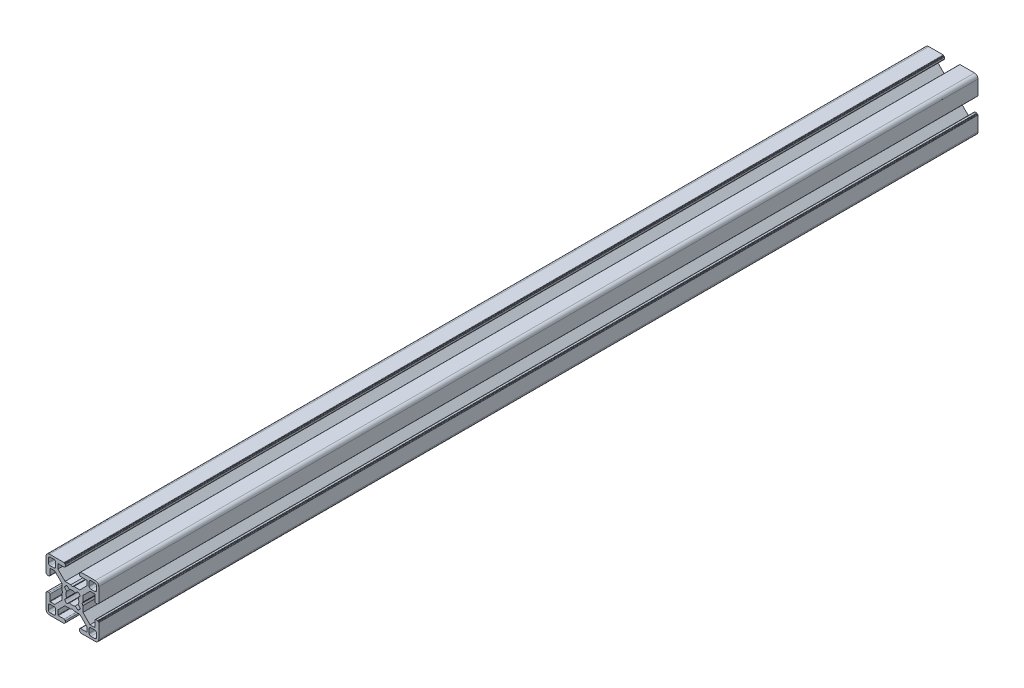
from build123d import *

# Parameters (mm, degrees)
DODANIE_WYCI_GNI_CIE1_DEPTH = 500


with BuildPart() as part:
    # Szkic1 → Dodanie-wyciągnięcie1 (new body)
    with BuildSketch(Plane.XY):
        with BuildLine():
            Line((96.56, 29.575148163), (97.459999946, 29.06))
            Line((97.459999946, 29.06), (100.764466193, 29.06))
            Line((100.764466193, 29.06), (104.810000327, 25.010000763))
            Line((104.810000327, 25.010000763), (104.810000327, 22.460001166))
            ThreePointArc((104.810000327, 22.460001166), (104.751421565, 22.318579525), (104.609999924, 22.260000763))
            Line((104.609999924, 22.260000763), (101.210000197, 22.260000763))
            ThreePointArc((101.210000197, 22.260000763), (100.785735989, 22.084264774), (100.61, 21.660000566))
            Line((100.61, 21.660000566), (100.61, 20.760000374))
            ThreePointArc((100.61, 20.760000374), (100.668578753, 20.618578753), (100.810000374, 20.56))
            Line((100.810000374, 20.56), (100.910000144, 20.56))
            ThreePointArc((100.910000144, 20.56), (101.05142109, 20.501421526), (101.109999564, 20.36000058))
            Line((101.109999564, 20.36000058), (101.109999564, 20.260000381))
            ThreePointArc((101.109999564, 20.260000381), (101.16857832, 20.118578755), (101.309999945, 20.06))
            Line((101.309999945, 20.06), (109.560000346, 20.06))
            ThreePointArc((109.560000346, 20.06), (110.974213664, 20.645786336), (111.56, 22.059999654))
            Line((111.56, 22.059999654), (111.56, 30.310000479))
            ThreePointArc((111.56, 30.310000479), (111.501421273, 30.451422036), (111.359999716, 30.510000763))
            Line((111.359999716, 30.510000763), (111.260000611, 30.510000763))
            ThreePointArc((111.260000611, 30.510000763), (111.118579054, 30.56857949), (111.060000327, 30.710001047))
            Line((111.060000327, 30.710001047), (111.060000327, 30.810000479))
            ThreePointArc((111.060000327, 30.810000479), (111.0014216, 30.951422036), (110.860000043, 31.010000763))
            Line((110.860000043, 31.010000763), (109.95999994, 31.010000763))
            ThreePointArc((109.95999994, 31.010000763), (109.535735606, 30.834264722), (109.359999564, 30.410000387))
            Line((109.359999564, 30.410000387), (109.359999564, 27.010000284))
            ThreePointArc((109.359999564, 27.010000284), (109.301420837, 26.868578727), (109.15999928, 26.81))
            Line((109.15999928, 26.81), (106.609999564, 26.81))
            Line((106.609999564, 26.81), (102.56446543, 30.855534134))
            Line((102.56446543, 30.855534134), (102.56446543, 34.160000381))
            Line((102.56446543, 34.160000381), (102.044852164, 35.06))
            Line((102.044852164, 35.06), (102.56446543, 35.959999619))
            Line((102.56446543, 35.959999619), (102.56446543, 39.264465866))
            Line((102.56446543, 39.264465866), (106.609999564, 43.31))
            Line((106.609999564, 43.31), (109.15999928, 43.31))
            ThreePointArc((109.15999928, 43.31), (109.301420837, 43.251421273), (109.359999564, 43.109999716))
            Line((109.359999564, 43.109999716), (109.359999564, 39.709999613))
            ThreePointArc((109.359999564, 39.709999613), (109.535735606, 39.285735278), (109.95999994, 39.109999237))
            Line((109.95999994, 39.109999237), (110.860000043, 39.109999237))
            ThreePointArc((110.860000043, 39.109999237), (111.0014216, 39.168577964), (111.060000327, 39.309999521))
            Line((111.060000327, 39.309999521), (111.060000327, 39.409998953))
            ThreePointArc((111.060000327, 39.409998953), (111.118579054, 39.55142051), (111.260000611, 39.609999237))
            Line((111.260000611, 39.609999237), (111.359999716, 39.609999237))
            ThreePointArc((111.359999716, 39.609999237), (111.501421273, 39.668577964), (111.56, 39.809999521))
            Line((111.56, 39.809999521), (111.56, 48.060000346))
            ThreePointArc((111.56, 48.060000346), (110.974213664, 49.474213664), (109.560000346, 50.06))
            Line((109.560000346, 50.06), (101.309999945, 50.06))
            ThreePointArc((101.309999945, 50.06), (101.16857832, 50.001421245), (101.109999564, 49.859999619))
            Line((101.109999564, 49.859999619), (101.109999564, 49.75999942))
            ThreePointArc((101.109999564, 49.75999942), (101.05142109, 49.618578474), (100.910000144, 49.56))
            Line((100.910000144, 49.56), (100.810000374, 49.56))
            ThreePointArc((100.810000374, 49.56), (100.668578753, 49.501421247), (100.61, 49.359999626))
            Line((100.61, 49.359999626), (100.61, 48.459999434))
            ThreePointArc((100.61, 48.459999434), (100.785735989, 48.035735226), (101.210000197, 47.859999237))
            Line((101.210000197, 47.859999237), (104.609999924, 47.859999237))
            ThreePointArc((104.609999924, 47.859999237), (104.751421565, 47.801420475), (104.810000327, 47.659998834))
            Line((104.810000327, 47.659998834), (104.810000327, 45.109999237))
            Line((104.810000327, 45.109999237), (100.764466193, 41.06))
            Line((100.764466193, 41.06), (97.459999946, 41.06))
            Line((97.459999946, 41.06), (96.56, 40.544851837))
            Line((96.56, 40.544851837), (95.660000054, 41.06))
            Line((95.660000054, 41.06), (92.355533807, 41.06))
            Line((92.355533807, 41.06), (88.309999673, 45.109999237))
            Line((88.309999673, 45.109999237), (88.309999673, 47.659998834))
            ThreePointArc((88.309999673, 47.659998834), (88.368578435, 47.801420475), (88.510000076, 47.859999237))
            Line((88.510000076, 47.859999237), (91.909999803, 47.859999237))
            ThreePointArc((91.909999803, 47.859999237), (92.334264011, 48.035735226), (92.51, 48.459999434))
            Line((92.51, 48.459999434), (92.51, 49.359999626))
            ThreePointArc((92.51, 49.359999626), (92.451421247, 49.501421247), (92.309999626, 49.56))
            Line((92.309999626, 49.56), (92.209999856, 49.56))
            ThreePointArc((92.209999856, 49.56), (92.06857891, 49.618578474), (92.010000436, 49.75999942))
            Line((92.010000436, 49.75999942), (92.010000436, 49.859999619))
            ThreePointArc((92.010000436, 49.859999619), (91.95142168, 50.001421245), (91.810000055, 50.06))
            Line((91.810000055, 50.06), (83.559999654, 50.06))
            ThreePointArc((83.559999654, 50.06), (82.145786336, 49.474213664), (81.56, 48.060000346))
            Line((81.56, 48.060000346), (81.56, 39.809999521))
            ThreePointArc((81.56, 39.809999521), (81.618578727, 39.668577964), (81.760000284, 39.609999237))
            Line((81.760000284, 39.609999237), (81.859999389, 39.609999237))
            ThreePointArc((81.859999389, 39.609999237), (82.001420946, 39.55142051), (82.059999673, 39.409998953))
            Line((82.059999673, 39.409998953), (82.059999673, 39.309999521))
            ThreePointArc((82.059999673, 39.309999521), (82.1185784, 39.168577964), (82.259999957, 39.109999237))
            Line((82.259999957, 39.109999237), (83.16000006, 39.109999237))
            ThreePointArc((83.16000006, 39.109999237), (83.584264394, 39.285735278), (83.760000436, 39.709999613))
            Line((83.760000436, 39.709999613), (83.760000436, 43.109999716))
            ThreePointArc((83.760000436, 43.109999716), (83.818579163, 43.251421273), (83.96000072, 43.31))
            Line((83.96000072, 43.31), (86.510000436, 43.31))
            Line((86.510000436, 43.31), (90.55553457, 39.264465866))
            Line((90.55553457, 39.264465866), (90.55553457, 35.959999619))
            Line((90.55553457, 35.959999619), (91.075147836, 35.06))
            Line((91.075147836, 35.06), (90.55553457, 34.160000381))
            Line((90.55553457, 34.160000381), (90.55553457, 30.855534134))
            Line((90.55553457, 30.855534134), (86.510000436, 26.81))
            Line((86.510000436, 26.81), (83.96000072, 26.81))
            ThreePointArc((83.96000072, 26.81), (83.818579163, 26.868578727), (83.760000436, 27.010000284))
            Line((83.760000436, 27.010000284), (83.760000436, 30.410000387))
            ThreePointArc((83.760000436, 30.410000387), (83.584264394, 30.834264722), (83.16000006, 31.010000763))
            Line((83.16000006, 31.010000763), (82.259999957, 31.010000763))
            ThreePointArc((82.259999957, 31.010000763), (82.1185784, 30.951422036), (82.059999673, 30.810000479))
            Line((82.059999673, 30.810000479), (82.059999673, 30.710001047))
            ThreePointArc((82.059999673, 30.710001047), (82.001420946, 30.56857949), (81.859999389, 30.510000763))
            Line((81.859999389, 30.510000763), (81.760000284, 30.510000763))
            ThreePointArc((81.760000284, 30.510000763), (81.618578727, 30.451422036), (81.56, 30.310000479))
            Line((81.56, 30.310000479), (81.56, 22.059999654))
            ThreePointArc((81.56, 22.059999654), (82.145786336, 20.645786336), (83.559999654, 20.06))
            Line((83.559999654, 20.06), (91.810000055, 20.06))
            ThreePointArc((91.810000055, 20.06), (91.95142168, 20.118578755), (92.010000436, 20.260000381))
            Line((92.010000436, 20.260000381), (92.010000436, 20.36000058))
            ThreePointArc((92.010000436, 20.36000058), (92.06857891, 20.501421526), (92.209999856, 20.56))
            Line((92.209999856, 20.56), (92.309999626, 20.56))
            ThreePointArc((92.309999626, 20.56), (92.451421247, 20.618578753), (92.51, 20.760000374))
            Line((92.51, 20.760000374), (92.51, 21.660000566))
            ThreePointArc((92.51, 21.660000566), (92.334264011, 22.084264774), (91.909999803, 22.260000763))
            Line((91.909999803, 22.260000763), (88.510000076, 22.260000763))
            ThreePointArc((88.510000076, 22.260000763), (88.368578435, 22.318579525), (88.309999673, 22.460001166))
            Line((88.309999673, 22.460001166), (88.309999673, 25.010000763))
            Line((88.309999673, 25.010000763), (92.355533807, 29.06))
            Line((92.355533807, 29.06), (95.660000054, 29.06))
            Line((95.660000054, 29.06), (96.56, 29.575148163))
        make_face()
        with BuildLine():
            Line((109.26000109, 48.760000398), (107.060000327, 48.760000398))
            ThreePointArc((107.060000327, 48.760000398), (106.352893543, 48.467107182), (106.060000327, 47.760000398))
            Line((106.060000327, 47.760000398), (106.060000327, 45.559999635))
            ThreePointArc((106.060000327, 45.559999635), (106.352893543, 44.852892851), (107.060000327, 44.559999635))
            Line((107.060000327, 44.559999635), (109.26000109, 44.559999635))
            ThreePointArc((109.26000109, 44.559999635), (109.967107874, 44.852892851), (110.26000109, 45.559999635))
            Line((110.26000109, 45.559999635), (110.26000109, 47.760000398))
            ThreePointArc((110.26000109, 47.760000398), (109.967107874, 48.467107182), (109.26000109, 48.760000398))
        make_face(mode=Mode.SUBTRACT)
        with BuildLine():
            Line((94.959870476, 38.340561767), (93.424070588, 39.578400903))
            ThreePointArc((93.424070588, 39.578400903), (92.678997741, 38.957155561), (92.054663108, 38.214669473))
            Line((92.054663108, 38.214669473), (93.279438268, 36.660129597))
            ThreePointArc((93.279438268, 36.660129597), (92.91, 35.06), (93.279438268, 33.459870403))
            Line((93.279438268, 33.459870403), (92.054663108, 31.905330527))
            ThreePointArc((92.054663108, 31.905330527), (92.678997741, 31.162844439), (93.424070588, 30.541599097))
            Line((93.424070588, 30.541599097), (94.959870476, 31.779438233))
            ThreePointArc((94.959870476, 31.779438233), (96.56, 31.41), (98.160129524, 31.779438233))
            Line((98.160129524, 31.779438233), (99.695929412, 30.541599097))
            ThreePointArc((99.695929412, 30.541599097), (100.441002259, 31.162844439), (101.065336892, 31.905330527))
            Line((101.065336892, 31.905330527), (99.840561732, 33.459870403))
            ThreePointArc((99.840561732, 33.459870403), (100.21, 35.06), (99.840561732, 36.660129597))
            Line((99.840561732, 36.660129597), (101.065336892, 38.214669473))
            ThreePointArc((101.065336892, 38.214669473), (100.441002259, 38.957155561), (99.695929412, 39.578400903))
            Line((99.695929412, 39.578400903), (98.160129524, 38.340561767))
            ThreePointArc((98.160129524, 38.340561767), (96.56, 38.71), (94.959870476, 38.340561767))
        make_face(mode=Mode.SUBTRACT)
        with BuildLine():
            Line((83.85999891, 21.359999602), (86.059999673, 21.359999602))
            ThreePointArc((86.059999673, 21.359999602), (86.767106457, 21.652892818), (87.059999673, 22.359999602))
            Line((87.059999673, 22.359999602), (87.059999673, 24.560000365))
            ThreePointArc((87.059999673, 24.560000365), (86.767106457, 25.267107149), (86.059999673, 25.560000365))
            Line((86.059999673, 25.560000365), (83.85999891, 25.560000365))
            ThreePointArc((83.85999891, 25.560000365), (83.152892126, 25.267107149), (82.85999891, 24.560000365))
            Line((82.85999891, 24.560000365), (82.85999891, 22.359999602))
            ThreePointArc((82.85999891, 22.359999602), (83.152892126, 21.652892818), (83.85999891, 21.359999602))
        make_face(mode=Mode.SUBTRACT)
        with BuildLine():
            Line((110.26000109, 22.359999602), (110.26000109, 24.560000365))
            ThreePointArc((110.26000109, 24.560000365), (109.967107874, 25.267107149), (109.26000109, 25.560000365))
            Line((109.26000109, 25.560000365), (107.060000327, 25.560000365))
            ThreePointArc((107.060000327, 25.560000365), (106.352893543, 25.267107149), (106.060000327, 24.560000365))
            Line((106.060000327, 24.560000365), (106.060000327, 22.359999602))
            ThreePointArc((106.060000327, 22.359999602), (106.352893543, 21.652892818), (107.060000327, 21.359999602))
            Line((107.060000327, 21.359999602), (109.26000109, 21.359999602))
            ThreePointArc((109.26000109, 21.359999602), (109.967107874, 21.652892818), (110.26000109, 22.359999602))
        make_face(mode=Mode.SUBTRACT)
        with BuildLine():
            Line((86.059999673, 48.760000398), (83.85999891, 48.760000398))
            ThreePointArc((83.85999891, 48.760000398), (83.152892126, 48.467107182), (82.85999891, 47.760000398))
            Line((82.85999891, 47.760000398), (82.85999891, 45.559999635))
            ThreePointArc((82.85999891, 45.559999635), (83.152892126, 44.852892851), (83.85999891, 44.559999635))
            Line((83.85999891, 44.559999635), (86.059999673, 44.559999635))
            ThreePointArc((86.059999673, 44.559999635), (86.767106457, 44.852892851), (87.059999673, 45.559999635))
            Line((87.059999673, 45.559999635), (87.059999673, 47.760000398))
            ThreePointArc((87.059999673, 47.760000398), (86.767106457, 48.467107182), (86.059999673, 48.760000398))
        make_face(mode=Mode.SUBTRACT)
    extrude(amount=DODANIE_WYCI_GNI_CIE1_DEPTH)


solid = part.part
